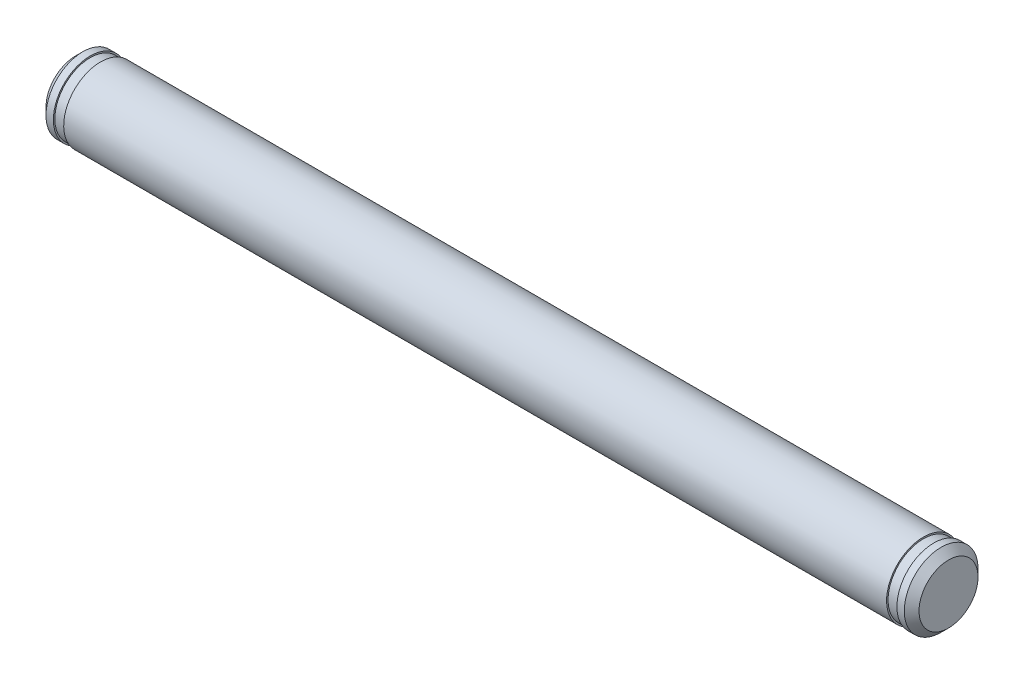
from build123d import *

# Parameters (mm, degrees)
CHAMFER_1_SIZE = 0.5


with BuildPart() as part:
    # 草图1 → 旋转1 (revolve)
    with BuildSketch(Plane.XY):
        Polygon((29.6, 0), (29.6, 2.5), (28.6, 2.5), (28.6, 2.4), (27.9, 2.4), (27.9, 2.5), (-27.9, 2.5), (-27.9, 2.4), (-28.6, 2.4), (-28.6, 2.5), (-29.6, 2.5), (-29.6, 0), align=None)
    revolve(axis=Axis((29.6, 0, 0), (-1, 0, 0)))

    # 倒角1
    chamfer_1_edges = [part.edges().sort_by_distance(p)[0] for p in [
        (-29.6, -2.5, 0),
        (29.6, -2.5, 0),
    ]]
    chamfer(chamfer_1_edges, length=CHAMFER_1_SIZE)


solid = part.part
